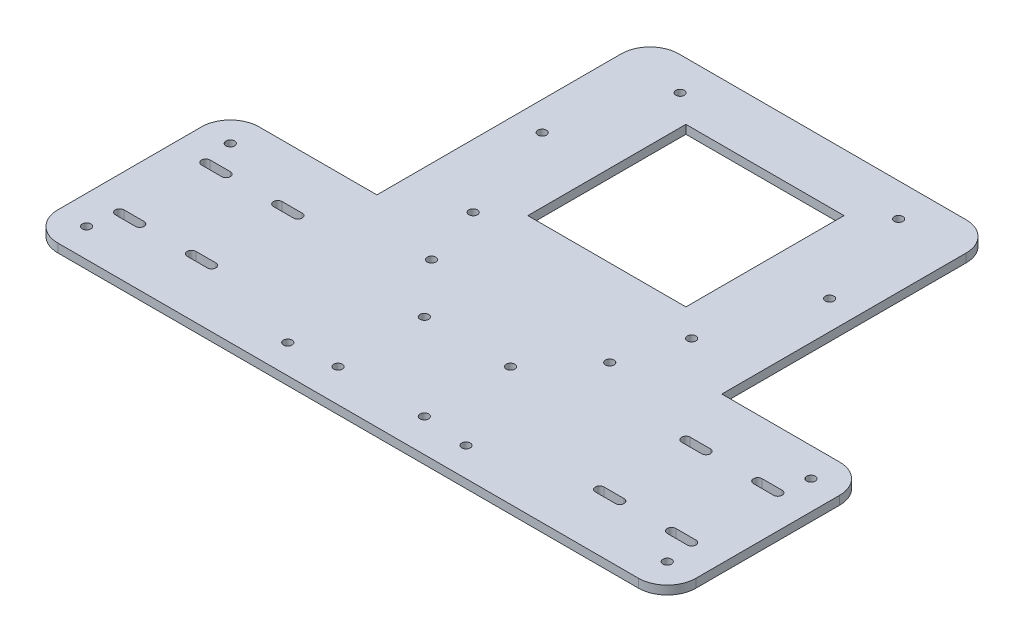
from build123d import *

# Parameters (mm, degrees)
SKETCH1_R           = 1.5
SKETCH1_W           = 55
SKETCH1_H           = 55
BOSS_EXTRUDE1_DEPTH = 3
FILLET1_R           = 10


with BuildPart() as part:
    # Sketch1 → Boss-Extrude1 (new body)
    with BuildSketch(Plane(origin=(0, 0, 0), x_dir=(1, 0, 0), z_dir=(0, 1, 0))):
        Polygon((-60, 130), (60, 130), (60, 35), (111, 35), (111, -35), (-111, -35), (-111, 35), (-60, 35), align=None)
        with Locations(Location((38, 118.5, 0), (0, 0, 270))):
            Circle(SKETCH1_R, mode=Mode.SUBTRACT)
        with Locations(Location((38, 46.5, 0), (0, 0, 270))):
            Circle(SKETCH1_R, mode=Mode.SUBTRACT)
        with Locations(Location((-38, 118.5, 0), (0, 0, 270))):
            Circle(SKETCH1_R, mode=Mode.SUBTRACT)
        with Locations(Location((-38, 46.5, 0), (0, 0, 270))):
            Circle(SKETCH1_R, mode=Mode.SUBTRACT)
        with Locations(Location((-15, 6.5, 0), (0, 0, 270))):
            Circle(SKETCH1_R, mode=Mode.SUBTRACT)
        with Locations(Location((15, 6.5, 0), (0, 0, 270))):
            Circle(SKETCH1_R, mode=Mode.SUBTRACT)
        with Locations(Location((15, -23.5, 0), (0, 0, 270))):
            Circle(SKETCH1_R, mode=Mode.SUBTRACT)
        with Locations(Location((-15, -23.5, 0), (0, 0, 270))):
            Circle(SKETCH1_R, mode=Mode.SUBTRACT)
        with Locations(Location((-50, 82.5, 0), (0, 0, 270))):
            Circle(SKETCH1_R, mode=Mode.SUBTRACT)
        with Locations(Location((-101, 25, 0), (0, 0, 270))):
            Circle(SKETCH1_R, mode=Mode.SUBTRACT)
        with Locations(Location((-101, -25, 0), (0, 0, 90))):
            Circle(SKETCH1_R, mode=Mode.SUBTRACT)
        with Locations(Location((-31, 25, 0), (0, 0, 270))):
            Circle(SKETCH1_R, mode=Mode.SUBTRACT)
        with Locations(Location((-31, -25, 0), (0, 0, 90))):
            Circle(SKETCH1_R, mode=Mode.SUBTRACT)
        with Locations(Location((101, 25, 0), (0, 0, 90))):
            Circle(SKETCH1_R, mode=Mode.SUBTRACT)
        with Locations(Location((101, -25, 0), (0, 0, 270))):
            Circle(SKETCH1_R, mode=Mode.SUBTRACT)
        with Locations(Location((31, -25, 0), (0, 0, 270))):
            Circle(SKETCH1_R, mode=Mode.SUBTRACT)
        with Locations(Location((31, 25, 0), (0, 0, 90))):
            Circle(SKETCH1_R, mode=Mode.SUBTRACT)
        with Locations(Location((50, 82.5, 0), (0, 0, 90))):
            Circle(SKETCH1_R, mode=Mode.SUBTRACT)
        with BuildLine():
            Line((74.5, -16.5), (67.5, -16.5))
            ThreePointArc((67.5, -16.5), (66, -15), (67.5, -13.5))
            Line((67.5, -13.5), (74.5, -13.5))
            ThreePointArc((74.5, -13.5), (76, -15), (74.5, -16.5))
        make_face(mode=Mode.SUBTRACT)
        with BuildLine():
            Line((74.5, 13.5), (67.5, 13.5))
            ThreePointArc((67.5, 13.5), (66, 15), (67.5, 16.5))
            Line((67.5, 16.5), (74.5, 16.5))
            ThreePointArc((74.5, 16.5), (76, 15), (74.5, 13.5))
        make_face(mode=Mode.SUBTRACT)
        with BuildLine():
            Line((92.5, 16.5), (99.5, 16.5))
            ThreePointArc((99.5, 16.5), (101, 15), (99.5, 13.5))
            Line((99.5, 13.5), (92.5, 13.5))
            ThreePointArc((92.5, 13.5), (91, 15), (92.5, 16.5))
        make_face(mode=Mode.SUBTRACT)
        with BuildLine():
            Line((92.5, -13.5), (99.5, -13.5))
            ThreePointArc((99.5, -13.5), (101, -15), (99.5, -16.5))
            Line((99.5, -16.5), (92.5, -16.5))
            ThreePointArc((92.5, -16.5), (91, -15), (92.5, -13.5))
        make_face(mode=Mode.SUBTRACT)
        with BuildLine():
            Line((-92.5, -16.5), (-99.5, -16.5))
            ThreePointArc((-99.5, -16.5), (-101, -15), (-99.5, -13.5))
            Line((-99.5, -13.5), (-92.5, -13.5))
            ThreePointArc((-92.5, -13.5), (-91, -15), (-92.5, -16.5))
        make_face(mode=Mode.SUBTRACT)
        with BuildLine():
            Line((-92.5, 13.5), (-99.5, 13.5))
            ThreePointArc((-99.5, 13.5), (-101, 15), (-99.5, 16.5))
            Line((-99.5, 16.5), (-92.5, 16.5))
            ThreePointArc((-92.5, 16.5), (-91, 15), (-92.5, 13.5))
        make_face(mode=Mode.SUBTRACT)
        with BuildLine():
            Line((-74.5, -13.5), (-67.5, -13.5))
            ThreePointArc((-67.5, -13.5), (-66, -15), (-67.5, -16.5))
            Line((-67.5, -16.5), (-74.5, -16.5))
            ThreePointArc((-74.5, -16.5), (-76, -15), (-74.5, -13.5))
        make_face(mode=Mode.SUBTRACT)
        with BuildLine():
            Line((-74.5, 16.5), (-67.5, 16.5))
            ThreePointArc((-67.5, 16.5), (-66, 15), (-67.5, 13.5))
            Line((-67.5, 13.5), (-74.5, 13.5))
            ThreePointArc((-74.5, 13.5), (-76, 15), (-74.5, 16.5))
        make_face(mode=Mode.SUBTRACT)
        with Locations((0, 82.5)):
            Rectangle(SKETCH1_W, SKETCH1_H, mode=Mode.SUBTRACT)
    extrude(amount=BOSS_EXTRUDE1_DEPTH)

    # Fillet1
    fillet1_edges = [part.edges().sort_by_distance(p)[0] for p in [
        (111, 1.5, -35),
        (111, 1.5, 35),
        (-111, 1.5, 35),
        (-111, 1.5, -35),
        (-60, 1.5, -130),
        (60, 1.5, -130),
    ]]
    fillet(fillet1_edges, radius=FILLET1_R)


solid = part.part
